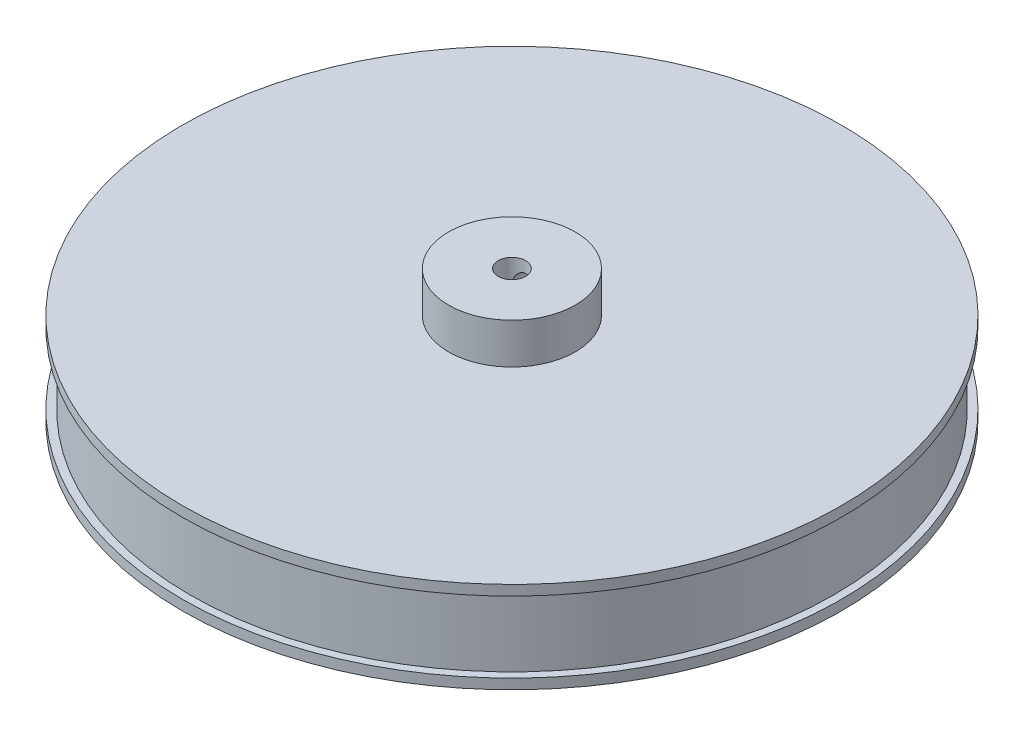
from build123d import *

# Parameters (mm, degrees)
SKETCH1_R           = 32.5
SKETCH1_R_2         = 1.35
BOSS_EXTRUDE1_DEPTH = 9
BOSS_EXTRUDE2_START = 9
SKETCH1_3_R         = 6.25
SKETCH1_3_R_2       = 1.35
BOSS_EXTRUDE2_DEPTH = 4
SKETCH2_W           = 0.75
SKETCH2_H           = 7
SKETCH3_R           = 0.9
CUT_EXTRUDE1_DEPTH  = 10


with BuildPart() as part:
    # Sketch1 → Boss-Extrude1 (new body)
    with BuildSketch(Plane(origin=(0, 0, 0), x_dir=(1, 0, 0), z_dir=(0, 1, 0))):
        with Locations(Location((0, 0, 0), (0, 0, 270))):
            Circle(SKETCH1_R)
        with Locations(Location((0, 0, 0), (0, 0, 270))):
            Circle(SKETCH1_R_2, mode=Mode.SUBTRACT)
    extrude(amount=BOSS_EXTRUDE1_DEPTH)

    # Sketch1<3> → Boss-Extrude2 (add)
    with BuildSketch(Plane(origin=(0, 0, 0), x_dir=(1, 0, 0), z_dir=(0, 1, 0)).offset(BOSS_EXTRUDE2_START)):
        with Locations(Location((0, 0, 0), (0, 0, 270))):
            Circle(SKETCH1_3_R)
        with Locations(Location((0, 0, 0), (0, 0, 270))):
            Circle(SKETCH1_3_R_2, mode=Mode.SUBTRACT)
    extrude(amount=BOSS_EXTRUDE2_DEPTH)

    # Sketch2 → Cut-Revolve1 (revolve, cut)
    with BuildSketch(Plane.XY, mode=Mode.PRIVATE) as cut_revolve1_sk:
        with Locations((32.125, 4.5)):
            Rectangle(SKETCH2_W, SKETCH2_H)
    revolve(cut_revolve1_sk.sketch.rotate(Axis((0, 9, 0), (0, -1, 0)), 90), axis=Axis((0, 9, 0), (0, -1, 0)), mode=Mode.SUBTRACT)

    # Sketch3 → Cut-Extrude1 (cut)
    with BuildSketch(Plane.XY):
        with Locations(Location((0, 11, 0), (0, 0, 90))):
            Circle(SKETCH3_R)
    extrude(amount=-CUT_EXTRUDE1_DEPTH, mode=Mode.SUBTRACT)


solid = part.part
